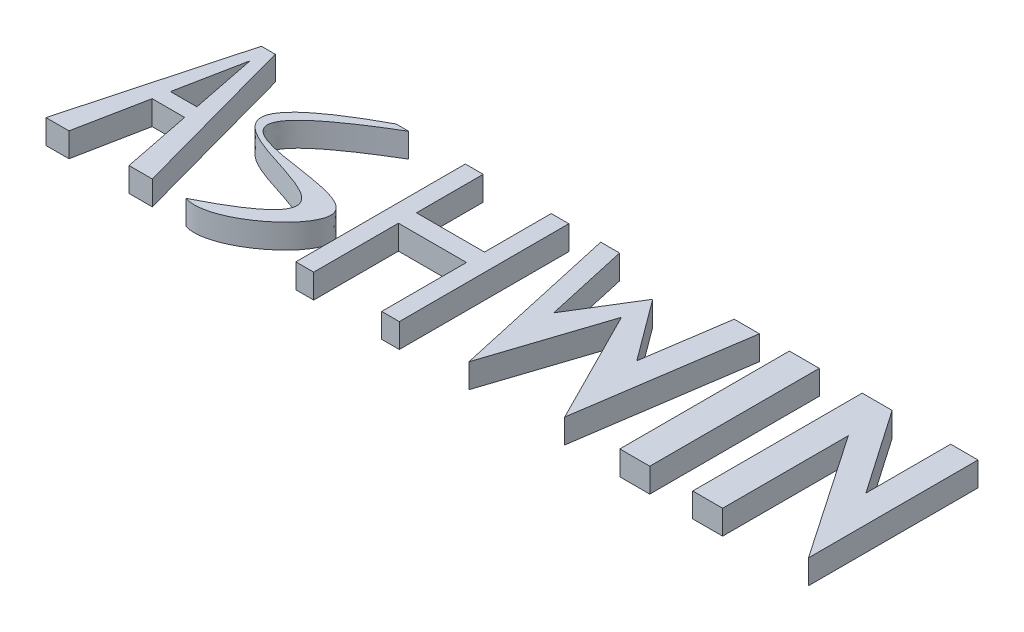
from build123d import *

# Parameters (mm, degrees)
BOSS_EXTRUDE1_DEPTH   = 10
BOSS_EXTRUDE1_2_DEPTH = 10
BOSS_EXTRUDE1_3_DEPTH = 10
BOSS_EXTRUDE1_4_DEPTH = 10
BOSS_EXTRUDE1_5_DEPTH = 10
SKETCH1_W             = 12.36015051
SKETCH1_H             = 70.020465147
BOSS_EXTRUDE1_6_DEPTH = 10


with BuildPart() as part:
    # Sketch1 → Boss-Extrude1 (new body)
    with BuildSketch(Plane(origin=(0, 0, 0), x_dir=(1, 0, 0), z_dir=(0, 1, 0))):
        Polygon((0, 0), (18.966582396, 70.020465147), (24.682538735, 70.020465147), (43.908937328, 0), (34.295738031, 0), (28.569257688, 28.692052555), (15.150120705, 28.692052555), (9.483291198, 0), align=None)
        Polygon((21.824560565, 62.485795428), (16.397994097, 35.010232574), (27.308248786, 35.010232574), align=None, mode=Mode.SUBTRACT)
    extrude(amount=BOSS_EXTRUDE1_DEPTH)


with BuildPart() as body_2:
    # Sketch1 → Boss-Extrude1 2 (new body)
    with BuildSketch(Plane(origin=(0, 0, 0), x_dir=(1, 0, 0), z_dir=(0, 1, 0))):
        with BuildLine():
            Line((74.561942632, 70.020465147), (79.789367499, 70.020465147))
            add(Edge.make_bspline(
                [(79.789367499, 70.020465147), (3.812346401, 24.911528702), (138.810461133, 50.824090878), (71.32127094, -4.287466603), (57.73314392, 0)],
                knots=[0, 0, 0, 0, 0.628481491, 1, 1, 1, 1], degree=3))
            add(Edge.make_bspline(
                [(74.561942632, 70.020465147), (-18.984373481, 19.61194677), (142.663839025, 42.738208807), (57.73314392, 0)],
                knots=[0, 0, 0, 0, 1, 1, 1, 1], degree=3))
        make_face()
    extrude(amount=BOSS_EXTRUDE1_2_DEPTH)


with BuildPart() as body_3:
    # Sketch1 → Boss-Extrude1 3 (new body)
    with BuildSketch(Plane(origin=(0, 0, 0), x_dir=(1, 0, 0), z_dir=(0, 1, 0))):
        Polygon((103.208059562, 70.020465147), (103.208059562, 0), (110.577241701, 0), (110.577241701, 35.010232574), (138.672248606, 35.010232574), (138.672248606, 0), (145.949605986, 0), (145.949605986, 70.020465147), (138.672248606, 70.020465147), (138.672248606, 42.458982771), (110.577241701, 42.458982771), (110.577241701, 70.020465147), align=None)
    extrude(amount=BOSS_EXTRUDE1_3_DEPTH)


with BuildPart() as body_4:
    # Sketch1 → Boss-Extrude1 4 (new body)
    with BuildSketch(Plane(origin=(0, 0, 0), x_dir=(1, 0, 0), z_dir=(0, 1, 0))):
        Polygon((159.120878447, 70.020465147), (174.705416046, 0), (190.289953645, 47.420838912), (214.251466133, 0), (224.683415933, 70.020465147), (214.251466133, 70.020465147), (209.035491234, 35.010232574), (190.289953645, 60.319199573), (174.705416046, 35.010232574), (166.913147247, 70.020465147), align=None)
    extrude(amount=BOSS_EXTRUDE1_4_DEPTH)


with BuildPart() as body_5:
    # Sketch1 → Boss-Extrude1 5 (new body)
    with BuildSketch(Plane(origin=(0, 0, 0), x_dir=(1, 0, 0), z_dir=(0, 1, 0))):
        Polygon((267.137845944, 0), (267.137845944, 70.020465147), (279.497996453, 70.020465147), (303.680899624, 35.010232574), (303.680899624, 70.020465147), (314.966254437, 70.020465147), (314.966254437, 0), (279.497996453, 51.925288761), (279.497996453, 0), align=None)
    extrude(amount=BOSS_EXTRUDE1_5_DEPTH)


with BuildPart() as body_6:
    # Sketch1 → Boss-Extrude1 6 (new body)
    with BuildSketch(Plane(origin=(0, 0, 0), x_dir=(1, 0, 0), z_dir=(0, 1, 0))):
        with Locations((243.223641697, 35.010232574)):
            Rectangle(SKETCH1_W, SKETCH1_H)
    extrude(amount=BOSS_EXTRUDE1_6_DEPTH)


solid = Compound([part.part, body_2.part, body_3.part, body_4.part, body_5.part, body_6.part])
